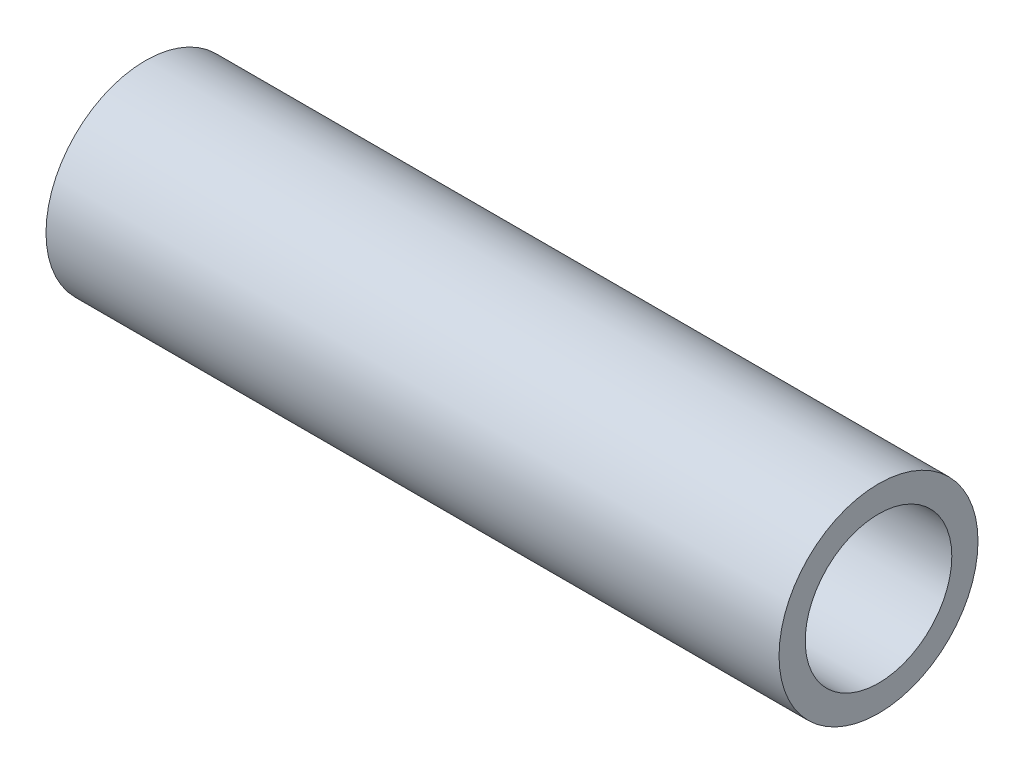
from build123d import *

# Parameters (mm, degrees)
SKETCH1_R           = 9.652
SKETCH1_R_2         = 7.112
BOSS_EXTRUDE1_DEPTH = 71.12


with BuildPart() as part:
    # Sketch1 → Boss-Extrude1 (new body)
    with BuildSketch(Plane(origin=(0, 0, 0), x_dir=(0, 0, -1), z_dir=(1, 0, 0))):
        Circle(SKETCH1_R)
        Circle(SKETCH1_R_2, mode=Mode.SUBTRACT)
    extrude(amount=BOSS_EXTRUDE1_DEPTH)


solid = part.part
